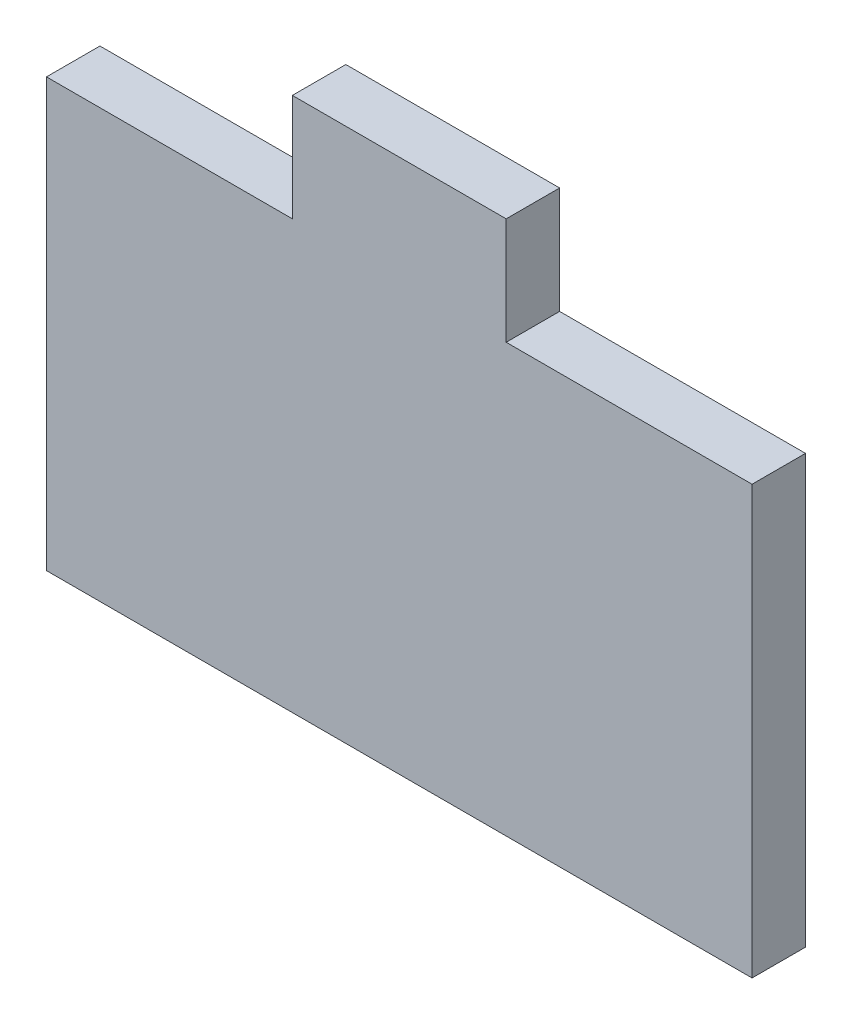
from build123d import *

# Parameters (mm, degrees)
SKETCH1_W           = 10
SKETCH1_H           = 5
SKETCH1_W_2         = 33
SKETCH1_H_2         = 20
BOSS_EXTRUDE1_DEPTH = 2.5


with BuildPart() as part:
    # Sketch1 → Boss-Extrude1 (new body)
    with BuildSketch(Plane.XY):
        with Locations((0, 12.5)):
            Rectangle(SKETCH1_W, SKETCH1_H)
        Rectangle(SKETCH1_W_2, SKETCH1_H_2)
    extrude(amount=BOSS_EXTRUDE1_DEPTH)


solid = part.part
